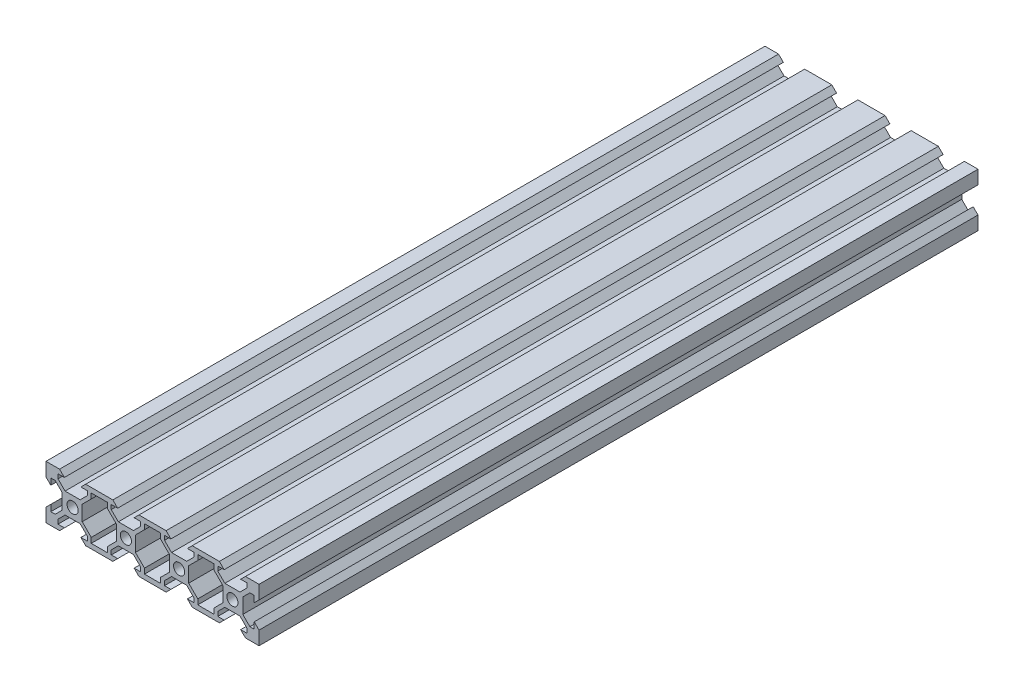
from build123d import *

# Parameters (mm, degrees)
ESQUISSE1_W             = 80
ESQUISSE1_H             = 20
BOSS_EXTRU_1_DEPTH      = 270
ENL_V_MAT_EXTRU_1_REACH = 280.109
ESQUISSE2_R             = 2.1
ENL_V_MAT_EXTRU_2_REACH = 280.109


with BuildPart() as part:
    # Esquisse1 → Boss.-Extru.1 (new body)
    with BuildSketch(Plane.XY):
        with Locations((-25.62771875, -1.733873274)):
            Rectangle(ESQUISSE1_W, ESQUISSE1_H)
    extrude(amount=BOSS_EXTRU_1_DEPTH)

    # Esquisse2 → Enlèv. mat.-Extru.1 (cut, up to next)
    with BuildSketch(Plane(origin=(0, 0, 0), x_dir=(-1, 0, 0), z_dir=(0, 0, -1)), mode=Mode.PRIVATE) as enl_v_mat_extru_1_sk1:
        with Locations((55.62771875, -1.733873274)):
            Circle(ESQUISSE2_R)
    enl_v_mat_extru_1_tool1 = extrude(enl_v_mat_extru_1_sk1.sketch, amount=-ENL_V_MAT_EXTRU_1_REACH, mode=Mode.PRIVATE) & part.part
    # Esquisse2 → Enlèv. mat.-Extru.1 (cut, up to next)
    with BuildSketch(Plane(origin=(0, 0, 0), x_dir=(-1, 0, 0), z_dir=(0, 0, -1)), mode=Mode.PRIVATE) as enl_v_mat_extru_1_sk2:
        with Locations((35.62771875, -1.733873274)):
            Circle(ESQUISSE2_R)
    enl_v_mat_extru_1_tool2 = extrude(enl_v_mat_extru_1_sk2.sketch, amount=-ENL_V_MAT_EXTRU_1_REACH, mode=Mode.PRIVATE) & part.part
    # Esquisse2 → Enlèv. mat.-Extru.1 (cut, up to next)
    with BuildSketch(Plane(origin=(0, 0, 0), x_dir=(-1, 0, 0), z_dir=(0, 0, -1)), mode=Mode.PRIVATE) as enl_v_mat_extru_1_sk3:
        with Locations((15.62771875, -1.733873274)):
            Circle(ESQUISSE2_R)
    enl_v_mat_extru_1_tool3 = extrude(enl_v_mat_extru_1_sk3.sketch, amount=-ENL_V_MAT_EXTRU_1_REACH, mode=Mode.PRIVATE) & part.part
    # Esquisse2 → Enlèv. mat.-Extru.1 (cut, up to next)
    with BuildSketch(Plane(origin=(0, 0, 0), x_dir=(-1, 0, 0), z_dir=(0, 0, -1)), mode=Mode.PRIVATE) as enl_v_mat_extru_1_sk4:
        with Locations((-4.37228125, -1.733873274)):
            Circle(ESQUISSE2_R)
    enl_v_mat_extru_1_tool4 = extrude(enl_v_mat_extru_1_sk4.sketch, amount=-ENL_V_MAT_EXTRU_1_REACH, mode=Mode.PRIVATE) & part.part
    # Esquisse2 → Enlèv. mat.-Extru.1 (cut, up to next)
    with BuildSketch(Plane(origin=(0, 0, 0), x_dir=(-1, 0, 0), z_dir=(0, 0, -1)), mode=Mode.PRIVATE) as enl_v_mat_extru_1_sk5:
        Polygon((50.72771875, 8.266126726), (60.52771875, 8.266126726), (58.72771875, 6.466126726), (61.12771875, 6.466126726), (61.12771875, 4.826126726), (58.46771875, 2.166126726), (52.78771875, 2.166126726), (50.12771875, 4.826126726), (50.12771875, 6.466126726), (52.52771875, 6.466126726), align=None)
    enl_v_mat_extru_1_tool5 = extrude(enl_v_mat_extru_1_sk5.sketch, amount=-ENL_V_MAT_EXTRU_1_REACH, mode=Mode.PRIVATE) & part.part
    # Esquisse2 → Enlèv. mat.-Extru.1 (cut, up to next)
    with BuildSketch(Plane(origin=(0, 0, 0), x_dir=(-1, 0, 0), z_dir=(0, 0, -1)), mode=Mode.PRIVATE) as enl_v_mat_extru_1_sk6:
        Polygon((65.62771875, 3.166126726), (65.62771875, -6.633873274), (63.82771875, -4.833873274), (63.82771875, -7.233873274), (62.18771875, -7.233873274), (59.52771875, -4.573873274), (59.52771875, 1.106126726), (62.18771875, 3.766126726), (63.82771875, 3.766126726), (63.82771875, 1.366126726), align=None)
    enl_v_mat_extru_1_tool6 = extrude(enl_v_mat_extru_1_sk6.sketch, amount=-ENL_V_MAT_EXTRU_1_REACH, mode=Mode.PRIVATE) & part.part
    # Esquisse2 → Enlèv. mat.-Extru.1 (cut, up to next)
    with BuildSketch(Plane(origin=(0, 0, 0), x_dir=(-1, 0, 0), z_dir=(0, 0, -1)), mode=Mode.PRIVATE) as enl_v_mat_extru_1_sk7:
        Polygon((60.52771875, -11.733873274), (50.72771875, -11.733873274), (52.52771875, -9.933873274), (50.12771875, -9.933873274), (50.12771875, -8.293873274), (52.78771875, -5.633873274), (58.46771875, -5.633873274), (61.12771875, -8.293873274), (61.12771875, -9.933873274), (58.72771875, -9.933873274), align=None)
    enl_v_mat_extru_1_tool7 = extrude(enl_v_mat_extru_1_sk7.sketch, amount=-ENL_V_MAT_EXTRU_1_REACH, mode=Mode.PRIVATE) & part.part
    # Esquisse2 → Enlèv. mat.-Extru.1 (cut, up to next)
    with BuildSketch(Plane(origin=(0, 0, 0), x_dir=(-1, 0, 0), z_dir=(0, 0, -1)), mode=Mode.PRIVATE) as enl_v_mat_extru_1_sk8:
        Polygon((30.72771875, 8.266126726), (40.52771875, 8.266126726), (38.72771875, 6.466126726), (41.12771875, 6.466126726), (41.12771875, 4.826126726), (38.46771875, 2.166126726), (32.78771875, 2.166126726), (30.12771875, 4.826126726), (30.12771875, 6.466126726), (32.52771875, 6.466126726), align=None)
    enl_v_mat_extru_1_tool8 = extrude(enl_v_mat_extru_1_sk8.sketch, amount=-ENL_V_MAT_EXTRU_1_REACH, mode=Mode.PRIVATE) & part.part
    # Esquisse2 → Enlèv. mat.-Extru.1 (cut, up to next)
    with BuildSketch(Plane(origin=(0, 0, 0), x_dir=(-1, 0, 0), z_dir=(0, 0, -1)), mode=Mode.PRIVATE) as enl_v_mat_extru_1_sk9:
        Polygon((40.52771875, -11.733873274), (30.72771875, -11.733873274), (32.52771875, -9.933873274), (30.12771875, -9.933873274), (30.12771875, -8.293873274), (32.78771875, -5.633873274), (38.46771875, -5.633873274), (41.12771875, -8.293873274), (41.12771875, -9.933873274), (38.72771875, -9.933873274), align=None)
    enl_v_mat_extru_1_tool9 = extrude(enl_v_mat_extru_1_sk9.sketch, amount=-ENL_V_MAT_EXTRU_1_REACH, mode=Mode.PRIVATE) & part.part
    # Esquisse2 → Enlèv. mat.-Extru.1 (cut, up to next)
    with BuildSketch(Plane(origin=(0, 0, 0), x_dir=(-1, 0, 0), z_dir=(0, 0, -1)), mode=Mode.PRIVATE) as enl_v_mat_extru_1_sk10:
        Polygon((10.72771875, 8.266126726), (20.52771875, 8.266126726), (18.72771875, 6.466126726), (21.12771875, 6.466126726), (21.12771875, 4.826126726), (18.46771875, 2.166126726), (12.78771875, 2.166126726), (10.12771875, 4.826126726), (10.12771875, 6.466126726), (12.52771875, 6.466126726), align=None)
    enl_v_mat_extru_1_tool10 = extrude(enl_v_mat_extru_1_sk10.sketch, amount=-ENL_V_MAT_EXTRU_1_REACH, mode=Mode.PRIVATE) & part.part
    # Esquisse2 → Enlèv. mat.-Extru.1 (cut, up to next)
    with BuildSketch(Plane(origin=(0, 0, 0), x_dir=(-1, 0, 0), z_dir=(0, 0, -1)), mode=Mode.PRIVATE) as enl_v_mat_extru_1_sk11:
        Polygon((20.52771875, -11.733873274), (10.72771875, -11.733873274), (12.52771875, -9.933873274), (10.12771875, -9.933873274), (10.12771875, -8.293873274), (12.78771875, -5.633873274), (18.46771875, -5.633873274), (21.12771875, -8.293873274), (21.12771875, -9.933873274), (18.72771875, -9.933873274), align=None)
    enl_v_mat_extru_1_tool11 = extrude(enl_v_mat_extru_1_sk11.sketch, amount=-ENL_V_MAT_EXTRU_1_REACH, mode=Mode.PRIVATE) & part.part
    # Esquisse2 → Enlèv. mat.-Extru.1 (cut, up to next)
    with BuildSketch(Plane(origin=(0, 0, 0), x_dir=(-1, 0, 0), z_dir=(0, 0, -1)), mode=Mode.PRIVATE) as enl_v_mat_extru_1_sk12:
        Polygon((-9.27228125, 8.266126726), (0.52771875, 8.266126726), (-1.27228125, 6.466126726), (1.12771875, 6.466126726), (1.12771875, 4.826126726), (-1.53228125, 2.166126726), (-7.21228125, 2.166126726), (-9.87228125, 4.826126726), (-9.87228125, 6.466126726), (-7.47228125, 6.466126726), align=None)
    enl_v_mat_extru_1_tool12 = extrude(enl_v_mat_extru_1_sk12.sketch, amount=-ENL_V_MAT_EXTRU_1_REACH, mode=Mode.PRIVATE) & part.part
    # Esquisse2 → Enlèv. mat.-Extru.1 (cut, up to next)
    with BuildSketch(Plane(origin=(0, 0, 0), x_dir=(-1, 0, 0), z_dir=(0, 0, -1)), mode=Mode.PRIVATE) as enl_v_mat_extru_1_sk13:
        Polygon((0.52771875, -11.733873274), (-9.27228125, -11.733873274), (-7.47228125, -9.933873274), (-9.87228125, -9.933873274), (-9.87228125, -8.293873274), (-7.21228125, -5.633873274), (-1.53228125, -5.633873274), (1.12771875, -8.293873274), (1.12771875, -9.933873274), (-1.27228125, -9.933873274), align=None)
    enl_v_mat_extru_1_tool13 = extrude(enl_v_mat_extru_1_sk13.sketch, amount=-ENL_V_MAT_EXTRU_1_REACH, mode=Mode.PRIVATE) & part.part
    # Esquisse2 → Enlèv. mat.-Extru.1 (cut, up to next)
    with BuildSketch(Plane(origin=(0, 0, 0), x_dir=(-1, 0, 0), z_dir=(0, 0, -1)), mode=Mode.PRIVATE) as enl_v_mat_extru_1_sk14:
        Polygon((-14.37228125, -6.633873274), (-14.37228125, 3.166126726), (-12.57228125, 1.366126726), (-12.57228125, 3.766126726), (-10.93228125, 3.766126726), (-8.27228125, 1.106126726), (-8.27228125, -4.573873274), (-10.93228125, -7.233873274), (-12.57228125, -7.233873274), (-12.57228125, -4.833873274), align=None)
    enl_v_mat_extru_1_tool14 = extrude(enl_v_mat_extru_1_sk14.sketch, amount=-ENL_V_MAT_EXTRU_1_REACH, mode=Mode.PRIVATE) & part.part
    add(enl_v_mat_extru_1_tool1.solids().sort_by_distance((-55.627719, -1.733873, 0))[0], mode=Mode.SUBTRACT)
    add(enl_v_mat_extru_1_tool2.solids().sort_by_distance((-35.627719, -1.733873, 0))[0], mode=Mode.SUBTRACT)
    add(enl_v_mat_extru_1_tool3.solids().sort_by_distance((-15.627719, -1.733873, 0))[0], mode=Mode.SUBTRACT)
    add(enl_v_mat_extru_1_tool4.solids().sort_by_distance((4.372281, -1.733873, 0))[0], mode=Mode.SUBTRACT)
    add(enl_v_mat_extru_1_tool5.solids().sort_by_distance((-55.627719, 5.301599, 0))[0], mode=Mode.SUBTRACT)
    add(enl_v_mat_extru_1_tool6.solids().sort_by_distance((-62.663191, -1.733873, 0))[0], mode=Mode.SUBTRACT)
    add(enl_v_mat_extru_1_tool7.solids().sort_by_distance((-55.627719, -8.769346, 0))[0], mode=Mode.SUBTRACT)
    add(enl_v_mat_extru_1_tool8.solids().sort_by_distance((-35.627719, 5.301599, 0))[0], mode=Mode.SUBTRACT)
    add(enl_v_mat_extru_1_tool9.solids().sort_by_distance((-35.627719, -8.769346, 0))[0], mode=Mode.SUBTRACT)
    add(enl_v_mat_extru_1_tool10.solids().sort_by_distance((-15.627719, 5.301599, 0))[0], mode=Mode.SUBTRACT)
    add(enl_v_mat_extru_1_tool11.solids().sort_by_distance((-15.627719, -8.769346, 0))[0], mode=Mode.SUBTRACT)
    add(enl_v_mat_extru_1_tool12.solids().sort_by_distance((4.372281, 5.301599, 0))[0], mode=Mode.SUBTRACT)
    add(enl_v_mat_extru_1_tool13.solids().sort_by_distance((4.372281, -8.769346, 0))[0], mode=Mode.SUBTRACT)
    add(enl_v_mat_extru_1_tool14.solids().sort_by_distance((11.407754, -1.733873, 0))[0], mode=Mode.SUBTRACT)

    # Esquisse3 → Enlèv. mat.-Extru.2 (cut, up to next)
    with BuildSketch(Plane(origin=(0, 0, 0), x_dir=(-1, 0, 0), z_dir=(0, 0, -1)), mode=Mode.PRIVATE) as enl_v_mat_extru_2_sk1:
        Polygon((2.618256699, 6.466126726), (8.637180802, 6.466126726), (8.637180802, 4.506126726), (12.037180802, 1.106126726), (12.037180802, -4.573873274), (8.637180802, -7.973873274), (8.637180802, -9.933873274), (2.618256699, -9.933873274), (2.618256699, -7.973873274), (-0.781743301, -4.573873274), (-0.781743301, 1.106126726), (2.618256699, 4.506126726), align=None)
    enl_v_mat_extru_2_tool1 = extrude(enl_v_mat_extru_2_sk1.sketch, amount=-ENL_V_MAT_EXTRU_2_REACH, mode=Mode.PRIVATE) & part.part
    # Esquisse3 → Enlèv. mat.-Extru.2 (cut, up to next)
    with BuildSketch(Plane(origin=(0, 0, 0), x_dir=(-1, 0, 0), z_dir=(0, 0, -1)), mode=Mode.PRIVATE) as enl_v_mat_extru_2_sk2:
        Polygon((22.618256699, 6.466126726), (28.637180802, 6.466126726), (28.637180802, 4.506126726), (32.037180802, 1.106126726), (32.037180802, -4.573873274), (28.637180802, -7.973873274), (28.637180802, -9.933873274), (22.618256699, -9.933873274), (22.618256699, -7.973873274), (19.218256699, -4.573873274), (19.218256699, 1.106126726), (22.618256699, 4.506126726), align=None)
    enl_v_mat_extru_2_tool2 = extrude(enl_v_mat_extru_2_sk2.sketch, amount=-ENL_V_MAT_EXTRU_2_REACH, mode=Mode.PRIVATE) & part.part
    # Esquisse3 → Enlèv. mat.-Extru.2 (cut, up to next)
    with BuildSketch(Plane(origin=(0, 0, 0), x_dir=(-1, 0, 0), z_dir=(0, 0, -1)), mode=Mode.PRIVATE) as enl_v_mat_extru_2_sk3:
        Polygon((42.618256699, 6.466126726), (48.637180802, 6.466126726), (48.637180802, 4.506126726), (52.037180802, 1.106126726), (52.037180802, -4.573873274), (48.637180802, -7.973873274), (48.637180802, -9.933873274), (42.618256699, -9.933873274), (42.618256699, -7.973873274), (39.218256699, -4.573873274), (39.218256699, 1.106126726), (42.618256699, 4.506126726), align=None)
    enl_v_mat_extru_2_tool3 = extrude(enl_v_mat_extru_2_sk3.sketch, amount=-ENL_V_MAT_EXTRU_2_REACH, mode=Mode.PRIVATE) & part.part
    add(enl_v_mat_extru_2_tool1.solids().sort_by_distance((-5.627719, -1.733873, 0))[0], mode=Mode.SUBTRACT)
    add(enl_v_mat_extru_2_tool2.solids().sort_by_distance((-25.627719, -1.733873, 0))[0], mode=Mode.SUBTRACT)
    add(enl_v_mat_extru_2_tool3.solids().sort_by_distance((-45.627719, -1.733873, 0))[0], mode=Mode.SUBTRACT)


solid = part.part
